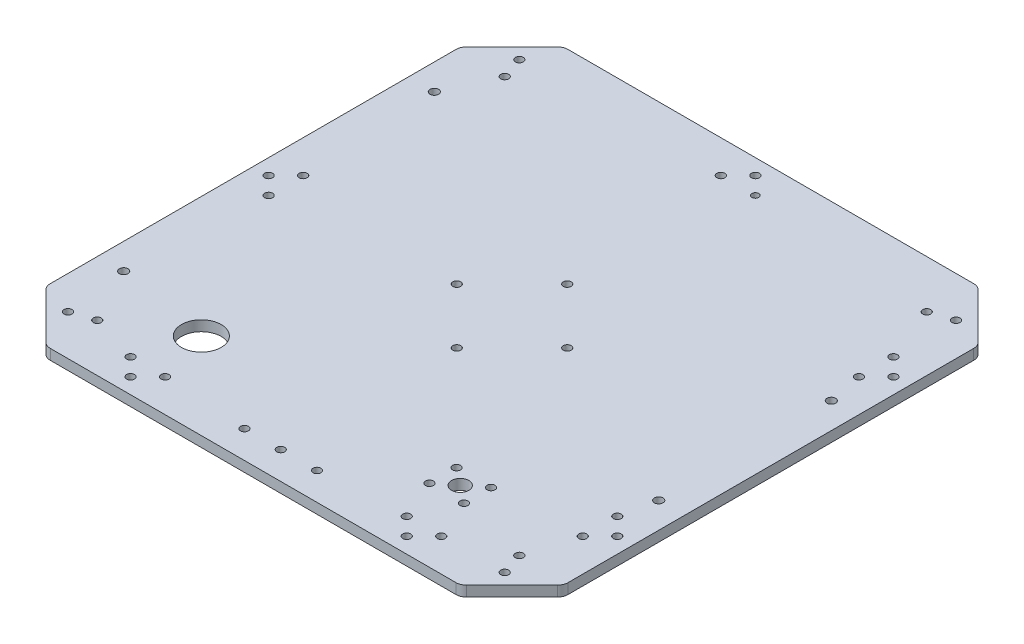
from build123d import *

# Parameters (mm, degrees)
BOSS_EXTRU_1_DEPTH       = 6
CONG_3_R                 = 6
ENL_V_MAT_EXTRU_9_REACH  = 214.217
ESQUISSE10_R             = 11.5
ENL_V_MAT_EXTRU_10_REACH = 214.217
ESQUISSE11_R             = 5
ESQUISSE11_R_2           = 2.3
ENL_V_MAT_EXTRU_14_REACH = 214.217
ESQUISSE15_R             = 2.3
ENL_V_MAT_EXTRU_15_REACH = 214.217
ESQUISSE14_R             = 2.3
ENL_V_MAT_EXTRU_16_REACH = 214.217
ESQUISSE13_R             = 2.3
ENL_V_MAT_EXTRU_17_REACH = 214.217
ESQUISSE16_R             = 2.3
ESQUISSE16_R_2           = 2
ENL_V_MAT_EXTRU_18_REACH = 214.217
ESQUISSE17_R             = 2.3
ENL_V_MAT_EXTRU_19_REACH = 214.217
ESQUISSE18_R             = 2.3
ENL_V_MAT_EXTRU_21_REACH = 214.217
ESQUISSE20_R             = 2.5
ENL_V_MAT_EXTRU_22_REACH = 214.217
ESQUISSE21_R             = 2.3


with BuildPart() as part:
    # Esquisse1 → Boss.-Extru.1 (new body)
    with BuildSketch(Plane(origin=(0, 0, 0), x_dir=(1, 0, 0), z_dir=(0, 1, 0))):
        Polygon((-150, 0), (-150, 120), (-120, 150), (0, 150), (120, 150), (150, 120), (150, 0), (150, -120), (120, -150), (0, -150), (-120, -150), (-150, -120), align=None)
    extrude(amount=BOSS_EXTRU_1_DEPTH)

    # Congé3
    cong_3_edges = [part.edges().sort_by_distance(p)[0] for p in [
        (-150, 3, -120),
        (-120, 3, -150),
        (120, 3, -150),
        (150, 3, -120),
        (150, 3, 120),
        (120, 3, 150),
        (-120, 3, 150),
        (-150, 3, 120),
    ]]
    fillet(cong_3_edges, radius=CONG_3_R)

    # Esquisse10 → Enlèv. mat.-Extru.9 (cut, up to next)
    with BuildSketch(Plane(origin=(0, 6, 0), x_dir=(1, 0, 0), z_dir=(0, 1, 0)), mode=Mode.PRIVATE) as enl_v_mat_extru_9_sk1:
        with Locations(Location((-80, -100, 0), (0, 0, 270))):
            Circle(ESQUISSE10_R)
    enl_v_mat_extru_9_tool1 = extrude(enl_v_mat_extru_9_sk1.sketch, amount=-ENL_V_MAT_EXTRU_9_REACH, mode=Mode.PRIVATE) & part.part
    add(enl_v_mat_extru_9_tool1.solids().sort_by_distance((-80, 6, 100))[0], mode=Mode.SUBTRACT)

    # Esquisse11 → Enlèv. mat.-Extru.10 (cut, up to next)
    with BuildSketch(Plane(origin=(0, 6, 0), x_dir=(1, 0, 0), z_dir=(0, 1, 0)), mode=Mode.PRIVATE) as enl_v_mat_extru_10_sk1:
        with Locations(Location((70, -100, 0), (0, 0, 270))):
            Circle(ESQUISSE11_R)
    enl_v_mat_extru_10_tool1 = extrude(enl_v_mat_extru_10_sk1.sketch, amount=-ENL_V_MAT_EXTRU_10_REACH, mode=Mode.PRIVATE) & part.part
    # Esquisse11 → Enlèv. mat.-Extru.10 (cut, up to next)
    with BuildSketch(Plane(origin=(0, 6, 0), x_dir=(1, 0, 0), z_dir=(0, 1, 0)), mode=Mode.PRIVATE) as enl_v_mat_extru_10_sk2:
        with Locations(Location((80, -107.85, 0), (0, 0, 270))):
            Circle(ESQUISSE11_R_2)
    enl_v_mat_extru_10_tool2 = extrude(enl_v_mat_extru_10_sk2.sketch, amount=-ENL_V_MAT_EXTRU_10_REACH, mode=Mode.PRIVATE) & part.part
    # Esquisse11 → Enlèv. mat.-Extru.10 (cut, up to next)
    with BuildSketch(Plane(origin=(0, 6, 0), x_dir=(1, 0, 0), z_dir=(0, 1, 0)), mode=Mode.PRIVATE) as enl_v_mat_extru_10_sk3:
        with Locations(Location((80, -92.15, 0), (0, 0, 270))):
            Circle(ESQUISSE11_R_2)
    enl_v_mat_extru_10_tool3 = extrude(enl_v_mat_extru_10_sk3.sketch, amount=-ENL_V_MAT_EXTRU_10_REACH, mode=Mode.PRIVATE) & part.part
    # Esquisse11 → Enlèv. mat.-Extru.10 (cut, up to next)
    with BuildSketch(Plane(origin=(0, 6, 0), x_dir=(1, 0, 0), z_dir=(0, 1, 0)), mode=Mode.PRIVATE) as enl_v_mat_extru_10_sk4:
        with Locations(Location((60, -92.15, 0), (0, 0, 270))):
            Circle(ESQUISSE11_R_2)
    enl_v_mat_extru_10_tool4 = extrude(enl_v_mat_extru_10_sk4.sketch, amount=-ENL_V_MAT_EXTRU_10_REACH, mode=Mode.PRIVATE) & part.part
    # Esquisse11 → Enlèv. mat.-Extru.10 (cut, up to next)
    with BuildSketch(Plane(origin=(0, 6, 0), x_dir=(1, 0, 0), z_dir=(0, 1, 0)), mode=Mode.PRIVATE) as enl_v_mat_extru_10_sk5:
        with Locations(Location((60, -107.85, 0), (0, 0, 270))):
            Circle(ESQUISSE11_R_2)
    enl_v_mat_extru_10_tool5 = extrude(enl_v_mat_extru_10_sk5.sketch, amount=-ENL_V_MAT_EXTRU_10_REACH, mode=Mode.PRIVATE) & part.part
    add(enl_v_mat_extru_10_tool1.solids().sort_by_distance((70, 6, 100))[0], mode=Mode.SUBTRACT)
    add(enl_v_mat_extru_10_tool2.solids().sort_by_distance((80, 6, 107.85))[0], mode=Mode.SUBTRACT)
    add(enl_v_mat_extru_10_tool3.solids().sort_by_distance((80, 6, 92.15))[0], mode=Mode.SUBTRACT)
    add(enl_v_mat_extru_10_tool4.solids().sort_by_distance((60, 6, 92.15))[0], mode=Mode.SUBTRACT)
    add(enl_v_mat_extru_10_tool5.solids().sort_by_distance((60, 6, 107.85))[0], mode=Mode.SUBTRACT)

    # Esquisse15 → Enlèv. mat.-Extru.14 (cut, up to next)
    with BuildSketch(Plane(origin=(0, 6, 0), x_dir=(1, 0, 0), z_dir=(0, 1, 0)), mode=Mode.PRIVATE) as enl_v_mat_extru_14_sk1:
        with Locations(Location((141, 80, 0), (0, 0, 270))):
            Circle(ESQUISSE15_R)
    enl_v_mat_extru_14_tool1 = extrude(enl_v_mat_extru_14_sk1.sketch, amount=-ENL_V_MAT_EXTRU_14_REACH, mode=Mode.PRIVATE) & part.part
    # Esquisse15 → Enlèv. mat.-Extru.14 (cut, up to next)
    with BuildSketch(Plane(origin=(0, 6, 0), x_dir=(1, 0, 0), z_dir=(0, 1, 0)), mode=Mode.PRIVATE) as enl_v_mat_extru_14_sk2:
        with Locations(Location((131, 70, 0), (0, 0, 270))):
            Circle(ESQUISSE15_R)
    enl_v_mat_extru_14_tool2 = extrude(enl_v_mat_extru_14_sk2.sketch, amount=-ENL_V_MAT_EXTRU_14_REACH, mode=Mode.PRIVATE) & part.part
    # Esquisse15 → Enlèv. mat.-Extru.14 (cut, up to next)
    with BuildSketch(Plane(origin=(0, 6, 0), x_dir=(1, 0, 0), z_dir=(0, 1, 0)), mode=Mode.PRIVATE) as enl_v_mat_extru_14_sk3:
        with Locations(Location((131, 90, 0), (0, 0, 270))):
            Circle(ESQUISSE15_R)
    enl_v_mat_extru_14_tool3 = extrude(enl_v_mat_extru_14_sk3.sketch, amount=-ENL_V_MAT_EXTRU_14_REACH, mode=Mode.PRIVATE) & part.part
    enl_v_mat_extru_14_1 = enl_v_mat_extru_14_tool1.solids().sort_by_distance((141, 6, -80))[0]
    add(enl_v_mat_extru_14_1, mode=Mode.SUBTRACT)
    enl_v_mat_extru_14_2 = enl_v_mat_extru_14_tool2.solids().sort_by_distance((131, 6, -70))[0]
    add(enl_v_mat_extru_14_2, mode=Mode.SUBTRACT)
    enl_v_mat_extru_14_3 = enl_v_mat_extru_14_tool3.solids().sort_by_distance((131, 6, -90))[0]
    add(enl_v_mat_extru_14_3, mode=Mode.SUBTRACT)
    enl_v_mat_extru_14 = enl_v_mat_extru_14_1 + enl_v_mat_extru_14_2 + enl_v_mat_extru_14_3  # Enlèv. mat.-Extru.14 as one shape, for the pattern or mirror that repeats it

    # Symétrie13: Enlèv. mat.-Extru.14 across plane
    add(enl_v_mat_extru_14.mirror(Plane.XY), mode=Mode.SUBTRACT)

    # Esquisse14 → Enlèv. mat.-Extru.15 (cut, up to next)
    with BuildSketch(Plane(origin=(0, 6, 0), x_dir=(1, 0, 0), z_dir=(0, 1, 0)), mode=Mode.PRIVATE) as enl_v_mat_extru_15_sk1:
        with Locations(Location((-80, -141, 0), (0, 0, 270))):
            Circle(ESQUISSE14_R)
    enl_v_mat_extru_15_tool1 = extrude(enl_v_mat_extru_15_sk1.sketch, amount=-ENL_V_MAT_EXTRU_15_REACH, mode=Mode.PRIVATE) & part.part
    # Esquisse14 → Enlèv. mat.-Extru.15 (cut, up to next)
    with BuildSketch(Plane(origin=(0, 6, 0), x_dir=(1, 0, 0), z_dir=(0, 1, 0)), mode=Mode.PRIVATE) as enl_v_mat_extru_15_sk2:
        with Locations(Location((-70, -131, 0), (0, 0, 270))):
            Circle(ESQUISSE14_R)
    enl_v_mat_extru_15_tool2 = extrude(enl_v_mat_extru_15_sk2.sketch, amount=-ENL_V_MAT_EXTRU_15_REACH, mode=Mode.PRIVATE) & part.part
    # Esquisse14 → Enlèv. mat.-Extru.15 (cut, up to next)
    with BuildSketch(Plane(origin=(0, 6, 0), x_dir=(1, 0, 0), z_dir=(0, 1, 0)), mode=Mode.PRIVATE) as enl_v_mat_extru_15_sk3:
        with Locations(Location((-90, -131, 0), (0, 0, 270))):
            Circle(ESQUISSE14_R)
    enl_v_mat_extru_15_tool3 = extrude(enl_v_mat_extru_15_sk3.sketch, amount=-ENL_V_MAT_EXTRU_15_REACH, mode=Mode.PRIVATE) & part.part
    enl_v_mat_extru_15_1 = enl_v_mat_extru_15_tool1.solids().sort_by_distance((-80, 6, 141))[0]
    add(enl_v_mat_extru_15_1, mode=Mode.SUBTRACT)
    enl_v_mat_extru_15_2 = enl_v_mat_extru_15_tool2.solids().sort_by_distance((-70, 6, 131))[0]
    add(enl_v_mat_extru_15_2, mode=Mode.SUBTRACT)
    enl_v_mat_extru_15_3 = enl_v_mat_extru_15_tool3.solids().sort_by_distance((-90, 6, 131))[0]
    add(enl_v_mat_extru_15_3, mode=Mode.SUBTRACT)
    enl_v_mat_extru_15 = enl_v_mat_extru_15_1 + enl_v_mat_extru_15_2 + enl_v_mat_extru_15_3  # Enlèv. mat.-Extru.15 as one shape, for the pattern or mirror that repeats it

    # Symétrie14: Enlèv. mat.-Extru.15 across plane
    add(enl_v_mat_extru_15.mirror(Plane(origin=(0, 0, 0), x_dir=(0, 0, 1), z_dir=(1, 0, 0))), mode=Mode.SUBTRACT)

    # Esquisse13 → Enlèv. mat.-Extru.16 (cut, up to next)
    with BuildSketch(Plane(origin=(0, 6, 0), x_dir=(1, 0, 0), z_dir=(0, 1, 0)), mode=Mode.PRIVATE) as enl_v_mat_extru_16_sk1:
        with Locations(Location((-141, 0, 0), (0, 0, 270))):
            Circle(ESQUISSE13_R)
    enl_v_mat_extru_16_tool1 = extrude(enl_v_mat_extru_16_sk1.sketch, amount=-ENL_V_MAT_EXTRU_16_REACH, mode=Mode.PRIVATE) & part.part
    # Esquisse13 → Enlèv. mat.-Extru.16 (cut, up to next)
    with BuildSketch(Plane(origin=(0, 6, 0), x_dir=(1, 0, 0), z_dir=(0, 1, 0)), mode=Mode.PRIVATE) as enl_v_mat_extru_16_sk2:
        with Locations(Location((-131, 10, 0), (0, 0, 270))):
            Circle(ESQUISSE13_R)
    enl_v_mat_extru_16_tool2 = extrude(enl_v_mat_extru_16_sk2.sketch, amount=-ENL_V_MAT_EXTRU_16_REACH, mode=Mode.PRIVATE) & part.part
    # Esquisse13 → Enlèv. mat.-Extru.16 (cut, up to next)
    with BuildSketch(Plane(origin=(0, 6, 0), x_dir=(1, 0, 0), z_dir=(0, 1, 0)), mode=Mode.PRIVATE) as enl_v_mat_extru_16_sk3:
        with Locations(Location((-131, -10, 0), (0, 0, 270))):
            Circle(ESQUISSE13_R)
    enl_v_mat_extru_16_tool3 = extrude(enl_v_mat_extru_16_sk3.sketch, amount=-ENL_V_MAT_EXTRU_16_REACH, mode=Mode.PRIVATE) & part.part
    add(enl_v_mat_extru_16_tool1.solids().sort_by_distance((-141, 6, 0))[0], mode=Mode.SUBTRACT)
    add(enl_v_mat_extru_16_tool2.solids().sort_by_distance((-131, 6, -10))[0], mode=Mode.SUBTRACT)
    add(enl_v_mat_extru_16_tool3.solids().sort_by_distance((-131, 6, 10))[0], mode=Mode.SUBTRACT)

    # Esquisse16 → Enlèv. mat.-Extru.17 (cut, up to next)
    with BuildSketch(Plane(origin=(0, 6, 0), x_dir=(1, 0, 0), z_dir=(0, 1, 0)), mode=Mode.PRIVATE) as enl_v_mat_extru_17_sk1:
        with Locations(Location((0, 141, 0), (0, 0, 270))):
            Circle(ESQUISSE16_R)
    enl_v_mat_extru_17_tool1 = extrude(enl_v_mat_extru_17_sk1.sketch, amount=-ENL_V_MAT_EXTRU_17_REACH, mode=Mode.PRIVATE) & part.part
    # Esquisse16 → Enlèv. mat.-Extru.17 (cut, up to next)
    with BuildSketch(Plane(origin=(0, 6, 0), x_dir=(1, 0, 0), z_dir=(0, 1, 0)), mode=Mode.PRIVATE) as enl_v_mat_extru_17_sk2:
        with Locations(Location((10, 131, 0), (0, 0, 270))):
            Circle(ESQUISSE16_R_2)
    enl_v_mat_extru_17_tool2 = extrude(enl_v_mat_extru_17_sk2.sketch, amount=-ENL_V_MAT_EXTRU_17_REACH, mode=Mode.PRIVATE) & part.part
    # Esquisse16 → Enlèv. mat.-Extru.17 (cut, up to next)
    with BuildSketch(Plane(origin=(0, 6, 0), x_dir=(1, 0, 0), z_dir=(0, 1, 0)), mode=Mode.PRIVATE) as enl_v_mat_extru_17_sk3:
        with Locations(Location((-10, 131, 0), (0, 0, 270))):
            Circle(ESQUISSE16_R)
    enl_v_mat_extru_17_tool3 = extrude(enl_v_mat_extru_17_sk3.sketch, amount=-ENL_V_MAT_EXTRU_17_REACH, mode=Mode.PRIVATE) & part.part
    add(enl_v_mat_extru_17_tool1.solids().sort_by_distance((0, 6, -141))[0], mode=Mode.SUBTRACT)
    add(enl_v_mat_extru_17_tool2.solids().sort_by_distance((10, 6, -131))[0], mode=Mode.SUBTRACT)
    add(enl_v_mat_extru_17_tool3.solids().sort_by_distance((-10, 6, -131))[0], mode=Mode.SUBTRACT)

    # Esquisse17 → Enlèv. mat.-Extru.18 (cut, up to next)
    with BuildSketch(Plane(origin=(0, 6, 0), x_dir=(1, 0, 0), z_dir=(0, 1, 0)), mode=Mode.PRIVATE) as enl_v_mat_extru_18_sk1:
        with Locations(Location((-130.757359313, -126.514718626, 0), (0, 0, 270))):
            Circle(ESQUISSE17_R)
    enl_v_mat_extru_18_tool1 = extrude(enl_v_mat_extru_18_sk1.sketch, amount=-ENL_V_MAT_EXTRU_18_REACH, mode=Mode.PRIVATE) & part.part
    # Esquisse17 → Enlèv. mat.-Extru.18 (cut, up to next)
    with BuildSketch(Plane(origin=(0, 6, 0), x_dir=(1, 0, 0), z_dir=(0, 1, 0)), mode=Mode.PRIVATE) as enl_v_mat_extru_18_sk2:
        with Locations(Location((-118.029437252, -122.272077939, 0), (0, 0, 270))):
            Circle(ESQUISSE17_R)
    enl_v_mat_extru_18_tool2 = extrude(enl_v_mat_extru_18_sk2.sketch, amount=-ENL_V_MAT_EXTRU_18_REACH, mode=Mode.PRIVATE) & part.part
    # Esquisse17 → Enlèv. mat.-Extru.18 (cut, up to next)
    with BuildSketch(Plane(origin=(0, 6, 0), x_dir=(1, 0, 0), z_dir=(0, 1, 0)), mode=Mode.PRIVATE) as enl_v_mat_extru_18_sk3:
        with Locations(Location((126.514718626, -130.757359313, 0), (0, 0, 270))):
            Circle(ESQUISSE17_R)
    enl_v_mat_extru_18_tool3 = extrude(enl_v_mat_extru_18_sk3.sketch, amount=-ENL_V_MAT_EXTRU_18_REACH, mode=Mode.PRIVATE) & part.part
    # Esquisse17 → Enlèv. mat.-Extru.18 (cut, up to next)
    with BuildSketch(Plane(origin=(0, 6, 0), x_dir=(1, 0, 0), z_dir=(0, 1, 0)), mode=Mode.PRIVATE) as enl_v_mat_extru_18_sk4:
        with Locations(Location((122.272077939, -118.029437252, 0), (0, 0, 270))):
            Circle(ESQUISSE17_R)
    enl_v_mat_extru_18_tool4 = extrude(enl_v_mat_extru_18_sk4.sketch, amount=-ENL_V_MAT_EXTRU_18_REACH, mode=Mode.PRIVATE) & part.part
    # Esquisse17 → Enlèv. mat.-Extru.18 (cut, up to next)
    with BuildSketch(Plane(origin=(0, 6, 0), x_dir=(1, 0, 0), z_dir=(0, 1, 0)), mode=Mode.PRIVATE) as enl_v_mat_extru_18_sk5:
        with Locations(Location((118.029437252, 122.272077939, 0), (0, 0, 270))):
            Circle(ESQUISSE17_R)
    enl_v_mat_extru_18_tool5 = extrude(enl_v_mat_extru_18_sk5.sketch, amount=-ENL_V_MAT_EXTRU_18_REACH, mode=Mode.PRIVATE) & part.part
    # Esquisse17 → Enlèv. mat.-Extru.18 (cut, up to next)
    with BuildSketch(Plane(origin=(0, 6, 0), x_dir=(1, 0, 0), z_dir=(0, 1, 0)), mode=Mode.PRIVATE) as enl_v_mat_extru_18_sk6:
        with Locations(Location((130.757359313, 126.514718626, 0), (0, 0, 270))):
            Circle(ESQUISSE17_R)
    enl_v_mat_extru_18_tool6 = extrude(enl_v_mat_extru_18_sk6.sketch, amount=-ENL_V_MAT_EXTRU_18_REACH, mode=Mode.PRIVATE) & part.part
    # Esquisse17 → Enlèv. mat.-Extru.18 (cut, up to next)
    with BuildSketch(Plane(origin=(0, 6, 0), x_dir=(1, 0, 0), z_dir=(0, 1, 0)), mode=Mode.PRIVATE) as enl_v_mat_extru_18_sk7:
        with Locations(Location((-126.514718626, 130.757359313, 0), (0, 0, 270))):
            Circle(ESQUISSE17_R)
    enl_v_mat_extru_18_tool7 = extrude(enl_v_mat_extru_18_sk7.sketch, amount=-ENL_V_MAT_EXTRU_18_REACH, mode=Mode.PRIVATE) & part.part
    # Esquisse17 → Enlèv. mat.-Extru.18 (cut, up to next)
    with BuildSketch(Plane(origin=(0, 6, 0), x_dir=(1, 0, 0), z_dir=(0, 1, 0)), mode=Mode.PRIVATE) as enl_v_mat_extru_18_sk8:
        with Locations(Location((-122.272077939, 118.029437252, 0), (0, 0, 270))):
            Circle(ESQUISSE17_R)
    enl_v_mat_extru_18_tool8 = extrude(enl_v_mat_extru_18_sk8.sketch, amount=-ENL_V_MAT_EXTRU_18_REACH, mode=Mode.PRIVATE) & part.part
    add(enl_v_mat_extru_18_tool1.solids().sort_by_distance((-130.757359, 6, 126.514719))[0], mode=Mode.SUBTRACT)
    add(enl_v_mat_extru_18_tool2.solids().sort_by_distance((-118.029437, 6, 122.272078))[0], mode=Mode.SUBTRACT)
    add(enl_v_mat_extru_18_tool3.solids().sort_by_distance((126.514719, 6, 130.757359))[0], mode=Mode.SUBTRACT)
    add(enl_v_mat_extru_18_tool4.solids().sort_by_distance((122.272078, 6, 118.029437))[0], mode=Mode.SUBTRACT)
    add(enl_v_mat_extru_18_tool5.solids().sort_by_distance((118.029437, 6, -122.272078))[0], mode=Mode.SUBTRACT)
    add(enl_v_mat_extru_18_tool6.solids().sort_by_distance((130.757359, 6, -126.514719))[0], mode=Mode.SUBTRACT)
    add(enl_v_mat_extru_18_tool7.solids().sort_by_distance((-126.514719, 6, -130.757359))[0], mode=Mode.SUBTRACT)
    add(enl_v_mat_extru_18_tool8.solids().sort_by_distance((-122.272078, 6, -118.029437))[0], mode=Mode.SUBTRACT)

    # Esquisse18 → Enlèv. mat.-Extru.19 (cut, up to next)
    with BuildSketch(Plane(origin=(0, 6, 0), x_dir=(1, 0, 0), z_dir=(0, 1, 0)), mode=Mode.PRIVATE) as enl_v_mat_extru_19_sk1:
        with Locations(Location((0, -32, 0), (0, 0, 270))):
            Circle(ESQUISSE18_R)
    enl_v_mat_extru_19_tool1 = extrude(enl_v_mat_extru_19_sk1.sketch, amount=-ENL_V_MAT_EXTRU_19_REACH, mode=Mode.PRIVATE) & part.part
    # Esquisse18 → Enlèv. mat.-Extru.19 (cut, up to next)
    with BuildSketch(Plane(origin=(0, 6, 0), x_dir=(1, 0, 0), z_dir=(0, 1, 0)), mode=Mode.PRIVATE) as enl_v_mat_extru_19_sk2:
        with Locations(Location((32, 0, 0), (0, 0, 270))):
            Circle(ESQUISSE18_R)
    enl_v_mat_extru_19_tool2 = extrude(enl_v_mat_extru_19_sk2.sketch, amount=-ENL_V_MAT_EXTRU_19_REACH, mode=Mode.PRIVATE) & part.part
    # Esquisse18 → Enlèv. mat.-Extru.19 (cut, up to next)
    with BuildSketch(Plane(origin=(0, 6, 0), x_dir=(1, 0, 0), z_dir=(0, 1, 0)), mode=Mode.PRIVATE) as enl_v_mat_extru_19_sk3:
        with Locations(Location((-32, 0, 0), (0, 0, 270))):
            Circle(ESQUISSE18_R)
    enl_v_mat_extru_19_tool3 = extrude(enl_v_mat_extru_19_sk3.sketch, amount=-ENL_V_MAT_EXTRU_19_REACH, mode=Mode.PRIVATE) & part.part
    # Esquisse18 → Enlèv. mat.-Extru.19 (cut, up to next)
    with BuildSketch(Plane(origin=(0, 6, 0), x_dir=(1, 0, 0), z_dir=(0, 1, 0)), mode=Mode.PRIVATE) as enl_v_mat_extru_19_sk4:
        with Locations(Location((0, 32, 0), (0, 0, 270))):
            Circle(ESQUISSE18_R)
    enl_v_mat_extru_19_tool4 = extrude(enl_v_mat_extru_19_sk4.sketch, amount=-ENL_V_MAT_EXTRU_19_REACH, mode=Mode.PRIVATE) & part.part
    add(enl_v_mat_extru_19_tool1.solids().sort_by_distance((0, 6, 32))[0], mode=Mode.SUBTRACT)
    add(enl_v_mat_extru_19_tool2.solids().sort_by_distance((32, 6, 0))[0], mode=Mode.SUBTRACT)
    add(enl_v_mat_extru_19_tool3.solids().sort_by_distance((-32, 6, 0))[0], mode=Mode.SUBTRACT)
    add(enl_v_mat_extru_19_tool4.solids().sort_by_distance((0, 6, -32))[0], mode=Mode.SUBTRACT)

    # Esquisse20 → Enlèv. mat.-Extru.21 (cut, up to next)
    with BuildSketch(Plane(origin=(0, 6, 0), x_dir=(1, 0, 0), z_dir=(0, 1, 0)), mode=Mode.PRIVATE) as enl_v_mat_extru_21_sk1:
        with Locations(Location((-135, -90, 0), (0, 0, 270))):
            Circle(ESQUISSE20_R)
    enl_v_mat_extru_21_tool1 = extrude(enl_v_mat_extru_21_sk1.sketch, amount=-ENL_V_MAT_EXTRU_21_REACH, mode=Mode.PRIVATE) & part.part
    # Esquisse20 → Enlèv. mat.-Extru.21 (cut, up to next)
    with BuildSketch(Plane(origin=(0, 6, 0), x_dir=(1, 0, 0), z_dir=(0, 1, 0)), mode=Mode.PRIVATE) as enl_v_mat_extru_21_sk2:
        with Locations(Location((-135, 90, 0), (0, 0, 270))):
            Circle(ESQUISSE20_R)
    enl_v_mat_extru_21_tool2 = extrude(enl_v_mat_extru_21_sk2.sketch, amount=-ENL_V_MAT_EXTRU_21_REACH, mode=Mode.PRIVATE) & part.part
    # Esquisse20 → Enlèv. mat.-Extru.21 (cut, up to next)
    with BuildSketch(Plane(origin=(0, 6, 0), x_dir=(1, 0, 0), z_dir=(0, 1, 0)), mode=Mode.PRIVATE) as enl_v_mat_extru_21_sk3:
        with Locations(Location((135, 50, 0), (0, 0, 270))):
            Circle(ESQUISSE20_R)
    enl_v_mat_extru_21_tool3 = extrude(enl_v_mat_extru_21_sk3.sketch, amount=-ENL_V_MAT_EXTRU_21_REACH, mode=Mode.PRIVATE) & part.part
    # Esquisse20 → Enlèv. mat.-Extru.21 (cut, up to next)
    with BuildSketch(Plane(origin=(0, 6, 0), x_dir=(1, 0, 0), z_dir=(0, 1, 0)), mode=Mode.PRIVATE) as enl_v_mat_extru_21_sk4:
        with Locations(Location((135, -50, 0), (0, 0, 270))):
            Circle(ESQUISSE20_R)
    enl_v_mat_extru_21_tool4 = extrude(enl_v_mat_extru_21_sk4.sketch, amount=-ENL_V_MAT_EXTRU_21_REACH, mode=Mode.PRIVATE) & part.part
    add(enl_v_mat_extru_21_tool1.solids().sort_by_distance((-135, 6, 90))[0], mode=Mode.SUBTRACT)
    add(enl_v_mat_extru_21_tool2.solids().sort_by_distance((-135, 6, -90))[0], mode=Mode.SUBTRACT)
    add(enl_v_mat_extru_21_tool3.solids().sort_by_distance((135, 6, -50))[0], mode=Mode.SUBTRACT)
    add(enl_v_mat_extru_21_tool4.solids().sort_by_distance((135, 6, 50))[0], mode=Mode.SUBTRACT)

    # Esquisse21 → Enlèv. mat.-Extru.22 (cut, up to next)
    with BuildSketch(Plane(origin=(0, 6, 0), x_dir=(1, 0, 0), z_dir=(0, 1, 0)), mode=Mode.PRIVATE) as enl_v_mat_extru_22_sk1:
        with Locations(Location((0, -134, 0), (0, 0, 270))):
            Circle(ESQUISSE21_R)
    enl_v_mat_extru_22_tool1 = extrude(enl_v_mat_extru_22_sk1.sketch, amount=-ENL_V_MAT_EXTRU_22_REACH, mode=Mode.PRIVATE) & part.part
    # Esquisse21 → Enlèv. mat.-Extru.22 (cut, up to next)
    with BuildSketch(Plane(origin=(0, 6, 0), x_dir=(1, 0, 0), z_dir=(0, 1, 0)), mode=Mode.PRIVATE) as enl_v_mat_extru_22_sk2:
        with Locations(Location((21, -134, 0), (0, 0, 270))):
            Circle(ESQUISSE21_R)
    enl_v_mat_extru_22_tool2 = extrude(enl_v_mat_extru_22_sk2.sketch, amount=-ENL_V_MAT_EXTRU_22_REACH, mode=Mode.PRIVATE) & part.part
    # Esquisse21 → Enlèv. mat.-Extru.22 (cut, up to next)
    with BuildSketch(Plane(origin=(0, 6, 0), x_dir=(1, 0, 0), z_dir=(0, 1, 0)), mode=Mode.PRIVATE) as enl_v_mat_extru_22_sk3:
        with Locations(Location((-21, -134, 0), (0, 0, 270))):
            Circle(ESQUISSE21_R)
    enl_v_mat_extru_22_tool3 = extrude(enl_v_mat_extru_22_sk3.sketch, amount=-ENL_V_MAT_EXTRU_22_REACH, mode=Mode.PRIVATE) & part.part
    add(enl_v_mat_extru_22_tool1.solids().sort_by_distance((0, 6, 134))[0], mode=Mode.SUBTRACT)
    add(enl_v_mat_extru_22_tool2.solids().sort_by_distance((21, 6, 134))[0], mode=Mode.SUBTRACT)
    add(enl_v_mat_extru_22_tool3.solids().sort_by_distance((-21, 6, 134))[0], mode=Mode.SUBTRACT)


solid = part.part
